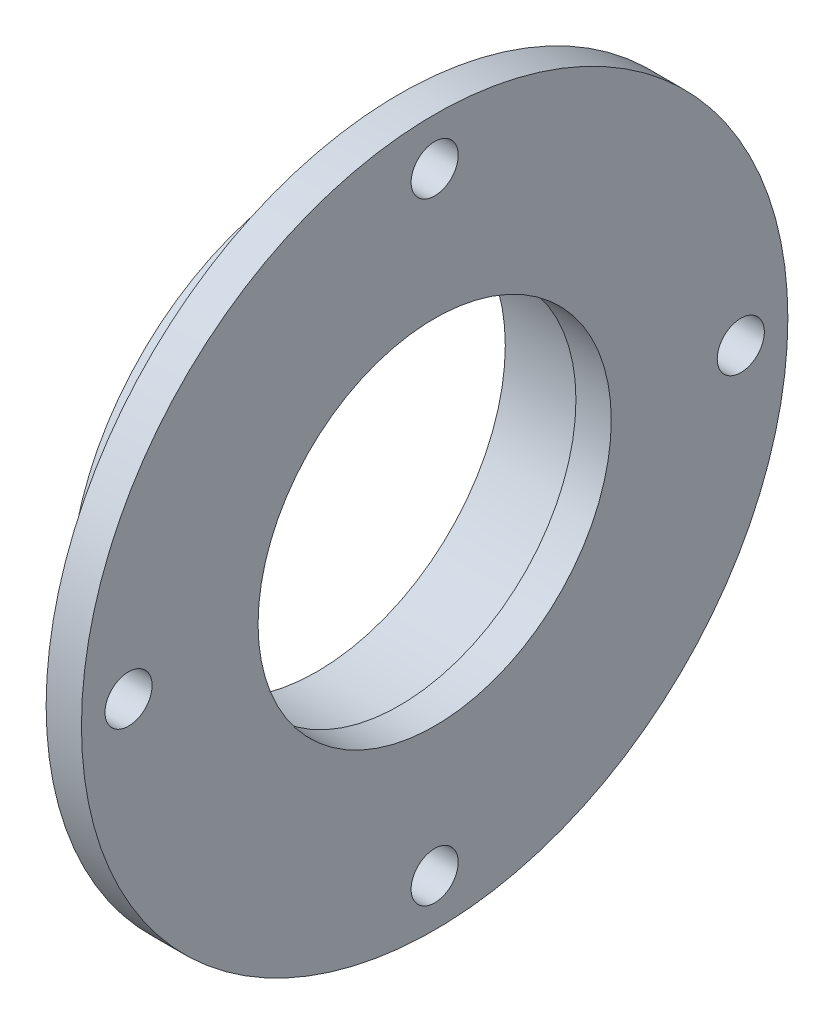
from build123d import *

# Parameters (mm, degrees)
SKETCH1_R           = 21
BOSS_EXTRUDE1_DEPTH = 7
SKETCH2_R           = 30
BOSS_EXTRUDE2_DEPTH = 3
SKETCH3_R           = 16
CUT_EXTRUDE1_DEPTH  = 44.588989435
SKETCH4_R           = 1.5
CUT_EXTRUDE2_DEPTH  = 5
BOSS_EXTRUDE3_START = -3
SKETCH5_R           = 16
SKETCH5_R_2         = 15
BOSS_EXTRUDE3_DEPTH = 3
SKETCH6_R           = 2
CUT_EXTRUDE3_DEPTH  = 44


with BuildPart() as part:
    # Sketch1 → Boss-Extrude1 (new body)
    with BuildSketch(Plane(origin=(0, 0, 0), x_dir=(0, 0, -1), z_dir=(1, 0, 0))):
        Circle(SKETCH1_R)
    extrude(amount=BOSS_EXTRUDE1_DEPTH)

    # Sketch2 → Boss-Extrude2 (add)
    with BuildSketch(Plane(origin=(7, 0, 0), x_dir=(0, 0, -1), z_dir=(1, 0, 0))):
        Circle(SKETCH2_R)
    extrude(amount=BOSS_EXTRUDE2_DEPTH)

    # Sketch3 → Cut-Extrude1 (cut, through all)
    with BuildSketch(Plane.ZY):
        Circle(SKETCH3_R)
    extrude(amount=-CUT_EXTRUDE1_DEPTH, mode=Mode.SUBTRACT)

    # Sketch4 → Cut-Extrude2 (cut)
    with BuildSketch(Plane.ZY):
        with Locations((0, 18.5)):
            Circle(SKETCH4_R)
        with Locations((18.5, 0)):
            Circle(SKETCH4_R)
        with Locations((0, -18.5)):
            Circle(SKETCH4_R)
        with Locations((-18.5, 0)):
            Circle(SKETCH4_R)
    extrude(amount=-CUT_EXTRUDE2_DEPTH, mode=Mode.SUBTRACT)

    # Sketch5 → Boss-Extrude3 (add)
    with BuildSketch(Plane(origin=(10, 0, 0), x_dir=(0, 0, -1), z_dir=(1, 0, 0)).offset(BOSS_EXTRUDE3_START)):
        with Locations(Location((0, 0, 0), (0, 0, 180))):
            Circle(SKETCH5_R)
        Circle(SKETCH5_R_2, mode=Mode.SUBTRACT)
    extrude(amount=BOSS_EXTRUDE3_DEPTH)

    # Sketch6 → Cut-Extrude3 (cut, through all)
    with BuildSketch(Plane.ZY.offset(-7)):
        with Locations((0, 26)):
            Circle(SKETCH6_R)
        with Locations((26, 0)):
            Circle(SKETCH6_R)
        with Locations((0, -26)):
            Circle(SKETCH6_R)
        with Locations((-26, 0)):
            Circle(SKETCH6_R)
    extrude(amount=-CUT_EXTRUDE3_DEPTH, mode=Mode.SUBTRACT)


solid = part.part
